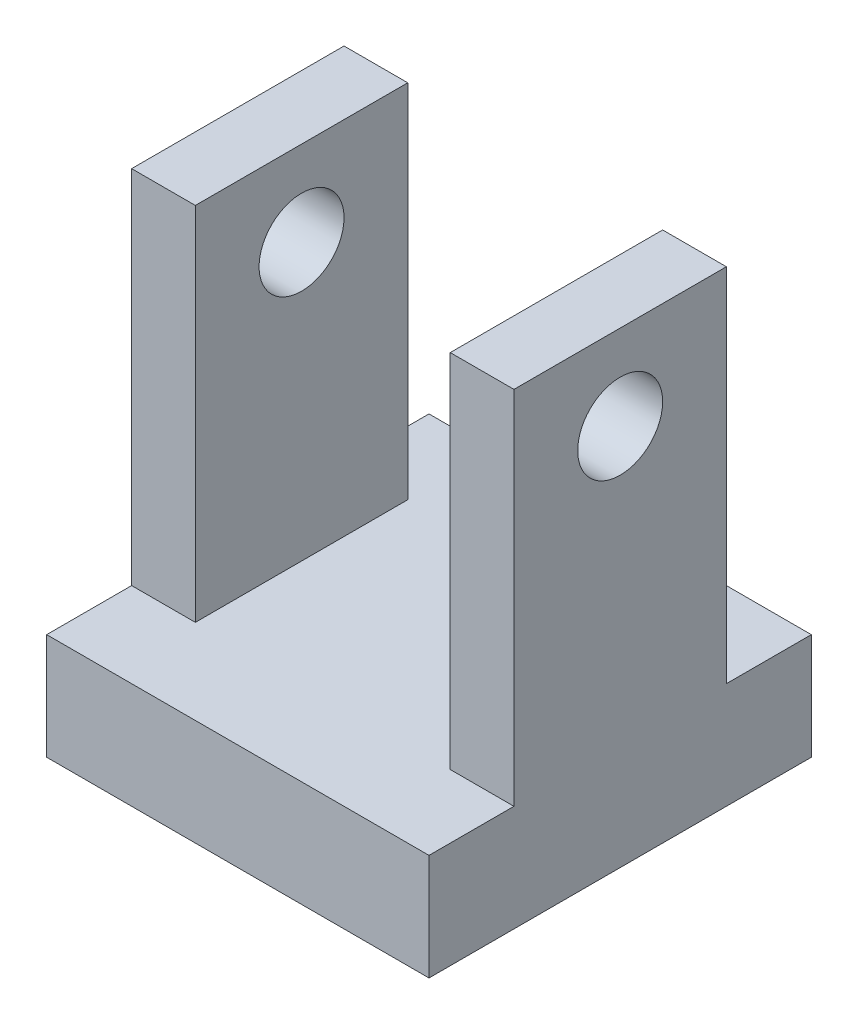
from build123d import *

# Parameters (mm, degrees)
SALIENTE_EXTRUIR1_DEPTH = 45
CORTAR_EXTRUIR1_DEPTH   = 90
CROQUIS3_R              = 10
CORTAR_EXTRUIR2_DEPTH   = 150.080515159


with BuildPart() as part:
    # Croquis1 → Saliente-Extruir1 (new, symmetric)
    with BuildSketch(Plane(origin=(0, 0, 0), x_dir=(0, 0, -1), z_dir=(1, 0, 0))):
        Polygon((45, 0), (-45, 0), (-45, 25), (-25, 25), (-25, 110), (25, 110), (25, 25), (45, 25), align=None)
    extrude(amount=SALIENTE_EXTRUIR1_DEPTH, both=True)

    # Croquis2 → Cortar-Extruir1 (cut)
    with BuildSketch(Plane.XY.offset(25)):
        Polygon((30, 25), (-30, 25), (-30, 110), (0, 110), (30, 110), align=None)
    extrude(amount=-CORTAR_EXTRUIR1_DEPTH, mode=Mode.SUBTRACT)

    # Croquis3 → Cortar-Extruir2 (cut, through all)
    with BuildSketch(Plane(origin=(45, 0, 0), x_dir=(0, 0, -1), z_dir=(1, 0, 0))):
        with Locations((0, 90)):
            Circle(CROQUIS3_R)
    extrude(amount=-CORTAR_EXTRUIR2_DEPTH, mode=Mode.SUBTRACT)


solid = part.part
